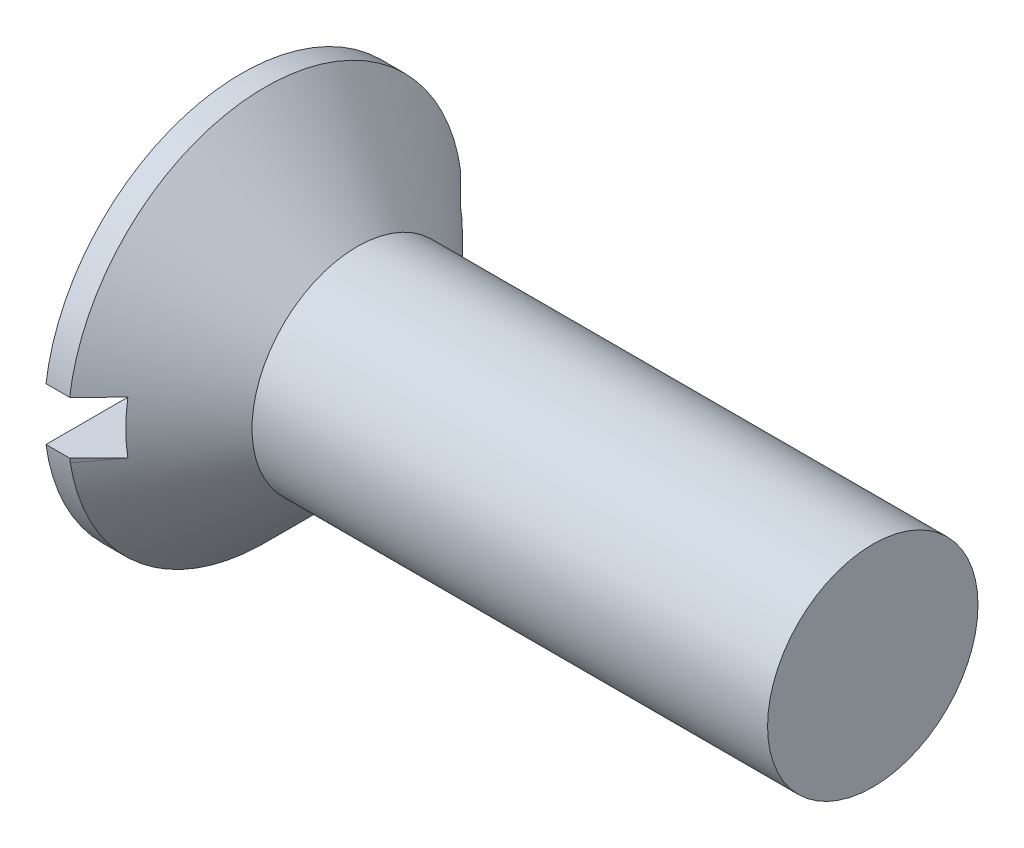
from build123d import *

# Parameters (mm, degrees)
SKETCH2_W          = 7.5
SKETCH2_H          = 1
CUT_EXTRUDE1_DEPTH = 1


with BuildPart() as part:
    # Sketch1 → Revolve1 (revolve)
    with BuildSketch(Plane.XY):
        Polygon((0, 0), (0, 3.75), (0.45, 3.75), (2.2, 2), (12, 2), (12, 0), align=None)
    revolve(axis=Axis((12, 0, 0), (-1, 0, 0)))

    # Sketch2 → Cut-Extrude1 (cut)
    with BuildSketch(Plane.ZY):
        Rectangle(SKETCH2_W, SKETCH2_H)
    extrude(amount=-CUT_EXTRUDE1_DEPTH, mode=Mode.SUBTRACT)


solid = part.part
